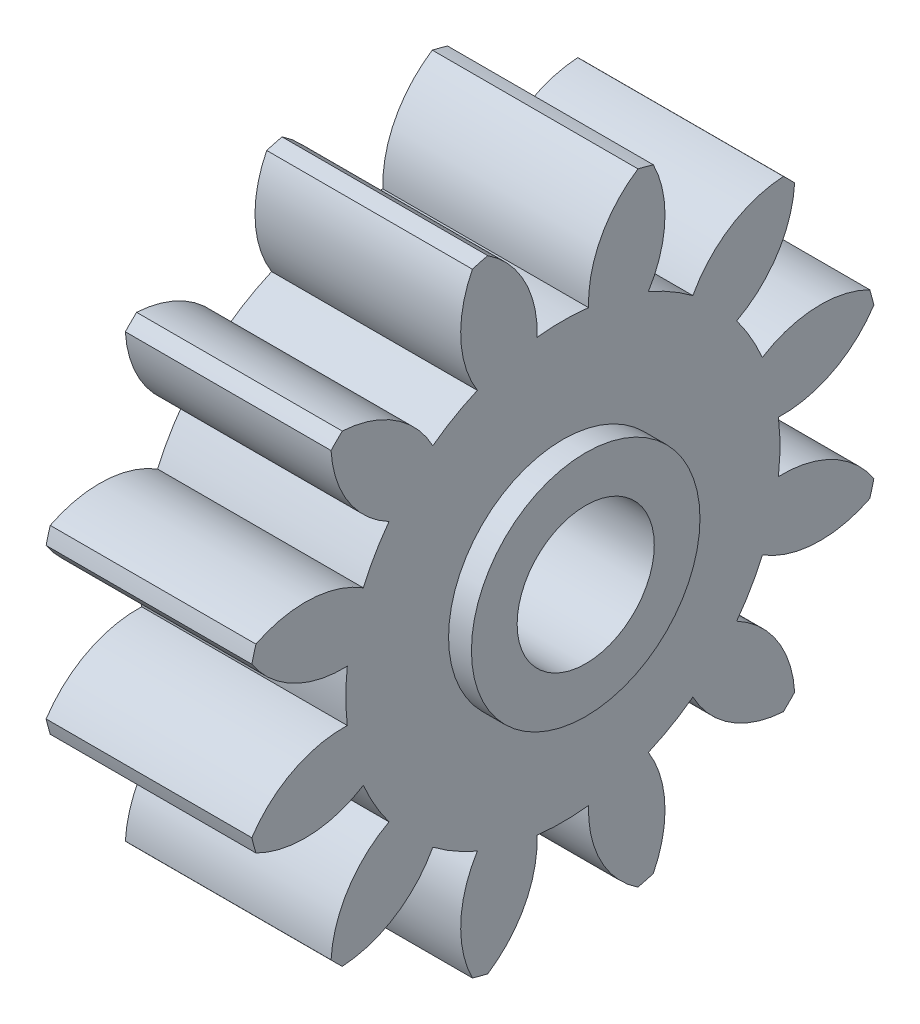
from build123d import *

# Parameters (mm, degrees)
BASPROSKE_W       = 4.5
BASPROSKE_H       = 7
TOOTHCUT_DEPTH    = 11.874281585
TEETHCUTS_COUNT   = 12
TEETHCUTS_ANGLE   = 330
HUBNEABOTSKE_R    = 2.5
HUBNEARBOTH_DEPTH = 0.5000254
HUBFAR_START      = 0.5000254
HUBFARSKE_R       = 2.5
HUBFAR_DEPTH      = 0.5000254
BORSKE_R          = 1.5
BORE_DEPTH        = 5.5000508


with BuildPart() as part:
    # BasProSke → Base-Revolve (revolve)
    with BuildSketch(Plane(origin=(0, 0, 0), x_dir=(1, 0, 0), z_dir=(0, 1, 0)), mode=Mode.PRIVATE) as base_revolve_sk:
        with Locations((2.25, 3.5)):
            Rectangle(BASPROSKE_W, BASPROSKE_H)
    revolve(base_revolve_sk.sketch.rotate(Axis((-10, 0, 0), (1, 0, 0)), 180), axis=Axis((-10, 0, 0), (1, 0, 0)))

    # TooCutSke → ToothCut (cut, through all)
    with BuildSketch(Plane(origin=(0, 0, 0), x_dir=(0, 0, -1), z_dir=(1, 0, 0))):
        with BuildLine():
            ThreePointArc((0.562207301, 4.715604304), (0, 4.749), (-0.562207301, 4.715604304))
            ThreePointArc((-0.562207301, 4.715604304), (-0.837528627, 5.917009812), (-1.672850686, 6.823328788))
            ThreePointArc((-1.672850686, 6.823328788), (0, 7.0254), (1.672850686, 6.823328788))
            ThreePointArc((1.672850686, 6.823328788), (0.837528627, 5.917009812), (0.562207301, 4.715604304))
        make_face()
    toothcut = extrude(amount=TOOTHCUT_DEPTH, mode=Mode.SUBTRACT)

    # TeethCuts: ToothCut ×12 about axis
    teethcuts_axis = Axis((-10, 0, 0), (1, 0, 0))
    for i in range(1, TEETHCUTS_COUNT):
        add(toothcut.rotate(teethcuts_axis, i * TEETHCUTS_ANGLE / (TEETHCUTS_COUNT - 1)), mode=Mode.SUBTRACT)

    # HubNeaBotSke → HubNearBoth (add)
    with BuildSketch(Plane.ZY):
        with Locations(Location((0, 0, 0), (0, 0, 180))):
            Circle(HUBNEABOTSKE_R)
    extrude(amount=HUBNEARBOTH_DEPTH)

    # HubFarSke → HubFar (add)
    with BuildSketch(Plane(origin=(4.5, 0, 0), x_dir=(0, 0, -1), z_dir=(1, 0, 0)).offset(HUBFAR_START)):
        Circle(HUBFARSKE_R)
    extrude(amount=-HUBFAR_DEPTH)

    # BorSke → Bore (cut, symmetric)
    with BuildSketch(Plane(origin=(0, 0, 0), x_dir=(0, 0, -1), z_dir=(1, 0, 0))):
        with Locations(Location((0, 0, 0), (0, 0, 180))):
            Circle(BORSKE_R)
    extrude(amount=BORE_DEPTH, both=True, mode=Mode.SUBTRACT)


solid = part.part
